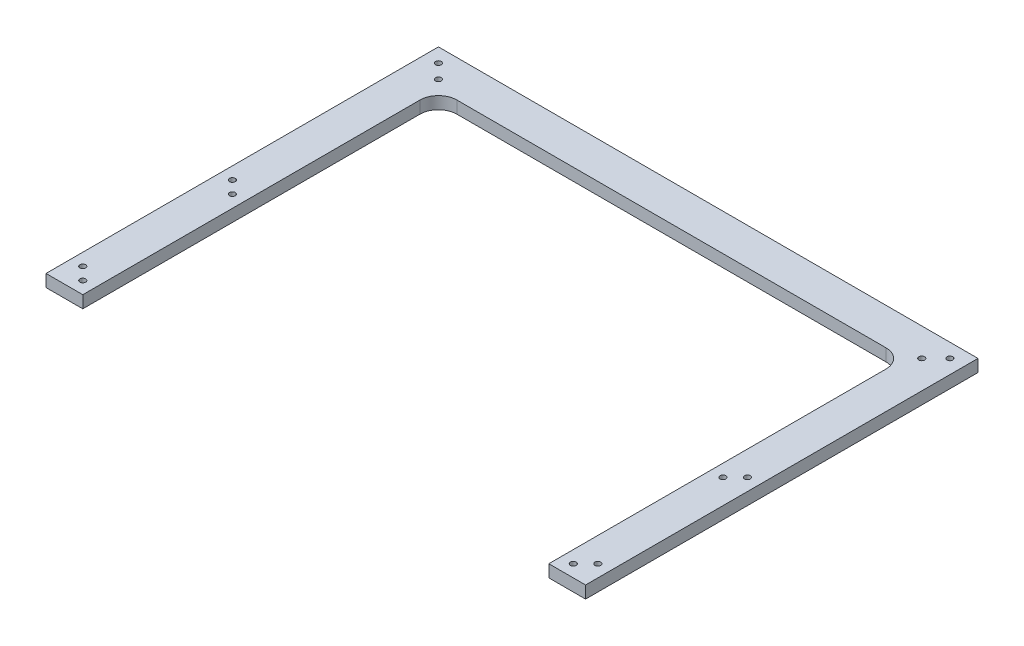
from build123d import *

# Parameters (mm, degrees)
BOSS_EXTRUDE1_DEPTH = 6.35
FILLET1_R           = 9.525
SKETCH2_R           = 1.5
CUT_EXTRUDE1_DEPTH  = 173.855351378
LPATTERN1_COUNT     = 2
LPATTERN1_PITCH     = 77.47


with BuildPart() as part:
    # Sketch1 → Boss-Extrude1 (new body)
    with BuildSketch(Plane(origin=(0, 0, 0), x_dir=(1, 0, 0), z_dir=(0, 1, 0))):
        Polygon((-120.65, -101.6), (-120.65, 82.55), (120.65, 82.55), (120.65, -101.6), (139.7, -101.6), (139.7, 101.6), (-139.7, 101.6), (-139.7, -101.6), align=None)
    extrude(amount=-BOSS_EXTRUDE1_DEPTH)

    # Fillet1
    fillet1_edges = [part.edges().sort_by_distance(p)[0] for p in [
        (120.65, -3.175, -82.55),
        (-120.65, -3.175, -82.55),
    ]]
    fillet(fillet1_edges, radius=FILLET1_R)

    # Sketch2 → Cut-Extrude1 (cut, through all)
    with BuildSketch(Plane(origin=(0, 0, 0), x_dir=(1, 0, 0), z_dir=(0, 1, 0))):
        with Locations(Location((-133.35, -88.9, 0), (0, 0, 270))):
            Circle(SKETCH2_R)
        with Locations(Location((-127, -95.25, 0), (0, 0, 270))):
            Circle(SKETCH2_R)
        with Locations(Location((133.35, -88.9, 0), (0, 0, 90))):
            Circle(SKETCH2_R)
        with Locations(Location((127, -95.25, 0), (0, 0, 90))):
            Circle(SKETCH2_R)
        with Locations(Location((132.42006403, 94.32006403, 0), (0, 0, 270))):
            Circle(SKETCH2_R)
        with Locations(Location((125.140128061, 87.040128061, 0), (0, 0, 270))):
            Circle(SKETCH2_R)
        with Locations(Location((-125.140128061, 87.040128061, 0), (0, 0, 90))):
            Circle(SKETCH2_R)
        with Locations(Location((-132.42006403, 94.32006403, 0), (0, 0, 90))):
            Circle(SKETCH2_R)
    cut_extrude1 = extrude(amount=-CUT_EXTRUDE1_DEPTH, mode=Mode.SUBTRACT)

    # LPattern1: Cut-Extrude1 ×2
    with Locations(*[(0, 0, -i * LPATTERN1_PITCH) for i in range(1, LPATTERN1_COUNT)]):
        add(cut_extrude1, mode=Mode.SUBTRACT)


solid = part.part
